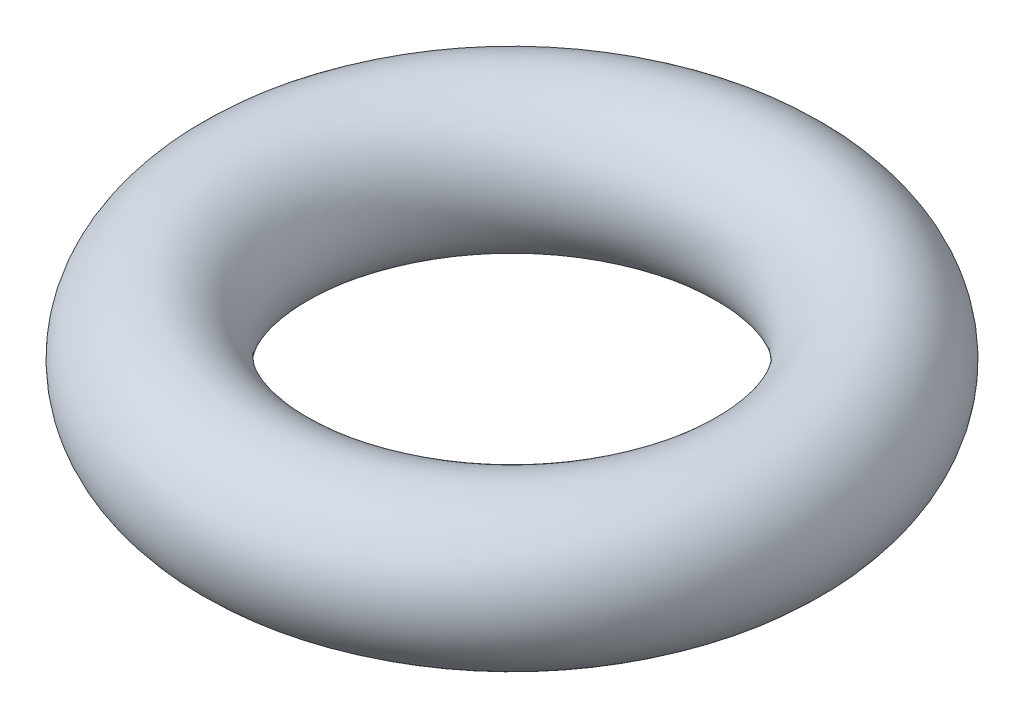
from build123d import *

# Parameters (mm, degrees)
SKETCH1_R = 1


with BuildPart() as part:
    # Sketch1 → Revolve1 (revolve)
    with BuildSketch(Plane.XY, mode=Mode.PRIVATE) as revolve1_sk:
        with Locations((3.5, 0)):
            Circle(SKETCH1_R)
    revolve(revolve1_sk.sketch.rotate(Axis((0, 0, 0), (0, 1, 0)), 90), axis=Axis((0, 0, 0), (0, 1, 0)))


solid = part.part
